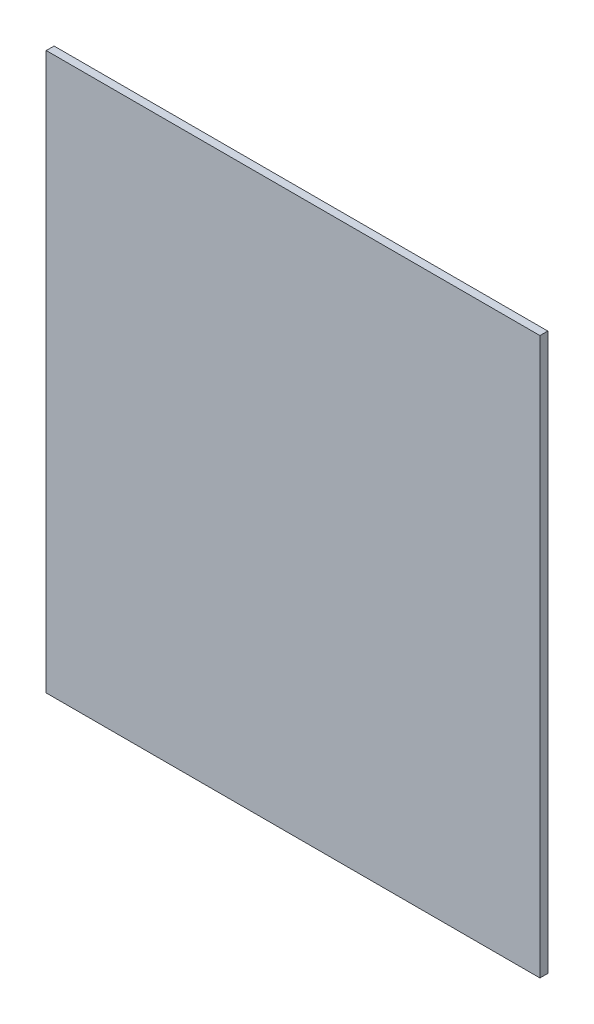
from build123d import *

# Parameters (mm, degrees)
SKETCH1_W           = 400.05
SKETCH1_H           = 450.85
BOSS_EXTRUDE1_DEPTH = 6.35


with BuildPart() as part:
    # Sketch1 → Boss-Extrude1 (new body)
    with BuildSketch(Plane.XY):
        Rectangle(SKETCH1_W, SKETCH1_H)
    extrude(amount=BOSS_EXTRUDE1_DEPTH)


solid = part.part
